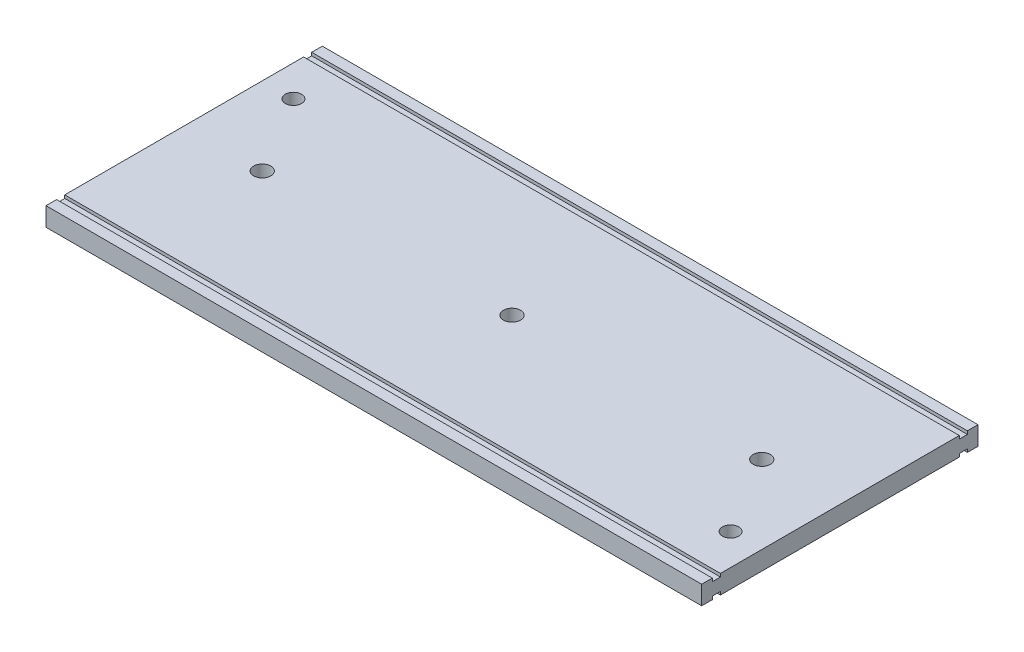
from build123d import *

# Parameters (mm, degrees)
SKETCH1_W           = 210
SKETCH1_H           = 88.5
SKETCH1_R           = 2.75
SKETCH1_R_2         = 2.6
BOSS_EXTRUDE1_DEPTH = 3
SKETCH2_W           = 210
SKETCH2_H           = 2.6
CUT_EXTRUDE1_DEPTH  = 1


with BuildPart() as part:
    # Sketch1 → Boss-Extrude1 (new, symmetric)
    with BuildSketch(Plane(origin=(0, 0, 0), x_dir=(1, 0, 0), z_dir=(0, 1, 0))):
        Rectangle(SKETCH1_W, SKETCH1_H)
        with Locations(Location((80, 0, 0), (0, 0, 270))):
            Circle(SKETCH1_R, mode=Mode.SUBTRACT)
        with Locations(Location((0, 0, 0), (0, 0, 270))):
            Circle(SKETCH1_R, mode=Mode.SUBTRACT)
        with Locations(Location((-80, 0, 0), (0, 0, 90))):
            Circle(SKETCH1_R, mode=Mode.SUBTRACT)
        with Locations(Location((-95, 25, 0), (0, 0, 270))):
            Circle(SKETCH1_R_2, mode=Mode.SUBTRACT)
        with Locations(Location((95, -25, 0), (0, 0, 270))):
            Circle(SKETCH1_R_2, mode=Mode.SUBTRACT)
    extrude(amount=BOSS_EXTRUDE1_DEPTH, both=True)

    # Sketch2 → Cut-Extrude1 (cut)
    with BuildSketch(Plane(origin=(0, 3, 0), x_dir=(1, 0, 0), z_dir=(0, 1, 0))):
        with Locations((0, 39.55)):
            Rectangle(SKETCH2_W, SKETCH2_H)
        with Locations((0, -39.55)):
            Rectangle(SKETCH2_W, SKETCH2_H)
    cut_extrude1 = extrude(amount=-CUT_EXTRUDE1_DEPTH, mode=Mode.SUBTRACT)

    # Mirror1: Cut-Extrude1 across plane
    add(cut_extrude1.mirror(Plane.ZX), mode=Mode.SUBTRACT)


solid = part.part
